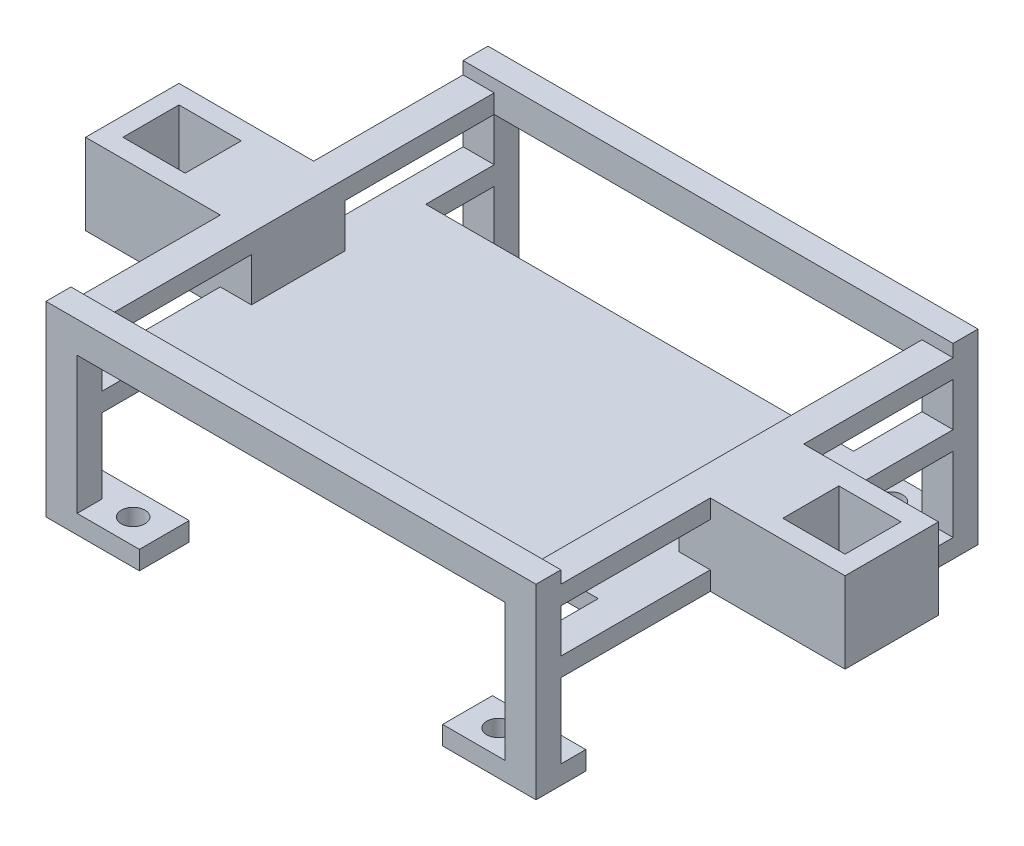
from build123d import *

# Parameters (mm, degrees)
SKETCH1_W             = 5
SKETCH1_H             = 63
BOSS_EXTRUDE1_DEPTH   = 3
BOSS_EXTRUDE1_2_DEPTH = 3
SKETCH3_W             = 78.71
SKETCH3_H             = 5
BOSS_EXTRUDE3_DEPTH   = 4
SKETCH4_W             = 78.71
SKETCH4_H             = 5
BOSS_EXTRUDE4_DEPTH   = 4
SKETCH6_W             = 15
SKETCH6_H             = 3
BOSS_EXTRUDE5_DEPTH   = 5.645
SKETCH7_W             = 16
SKETCH7_H             = 15
SKETCH7_W_2           = 10
SKETCH7_H_2           = 9
BOSS_EXTRUDE6_DEPTH   = 3
SKETCH5_W             = 5
SKETCH5_H             = 4
LEGS_DEPTH            = 25
SKETCH12_W            = 15
SKETCH12_H            = 8
SKETCH12_R            = 1.905
BOSS_EXTRUDE10_DEPTH  = 3
SKETCH13_W            = 21.645
SKETCH13_H            = 15
SKETCH13_W_2          = 10
SKETCH13_H_2          = 9
COPY_2_DEPTH          = 3
BOSS_EXTRUDE11_DEPTH  = 3
SKETCH15_W            = 10
SKETCH15_H            = 9
BOSS_EXTRUDE12_DEPTH  = 10


with BuildPart() as part:
    # Sketch1 → Boss-Extrude1 (new body)
    with BuildSketch(Plane(origin=(0, 0, 0), x_dir=(1, 0, 0), z_dir=(0, 1, 0))):
        with Locations((-36.855, 0)):
            Rectangle(SKETCH1_W, SKETCH1_H)
    extrude(amount=BOSS_EXTRUDE1_DEPTH)



with BuildPart() as body_2:
    # Sketch1 → Boss-Extrude1 2 (new body)
    with BuildSketch(Plane(origin=(0, 0, 0), x_dir=(1, 0, 0), z_dir=(0, 1, 0))):
        with Locations((36.855, 0)):
            Rectangle(SKETCH1_W, SKETCH1_H)
    extrude(amount=BOSS_EXTRUDE1_2_DEPTH)


with BuildPart() as part_1:
    add(part.part)

    add(body_2.part)  # Boss-Extrude3 merges body 2
    # Sketch3 → Boss-Extrude3 (add)
    with BuildSketch(Plane.XY.offset(31.5)):
        with Locations((0, 2.5)):
            Rectangle(SKETCH3_W, SKETCH3_H)
    extrude(amount=BOSS_EXTRUDE3_DEPTH)

    # Sketch4 → Boss-Extrude4 (add)
    with BuildSketch(Plane(origin=(0, 0, -31.5), x_dir=(-1, 0, 0), z_dir=(0, 0, -1))):
        with Locations((0, 2.5)):
            Rectangle(SKETCH4_W, SKETCH4_H)
    extrude(amount=BOSS_EXTRUDE4_DEPTH)

    # Sketch6 → Boss-Extrude5 (add)
    with BuildSketch(Plane.ZY.offset(39.355)):
        with Locations((0, 1.5)):
            Rectangle(SKETCH6_W, SKETCH6_H)
    extrude(amount=BOSS_EXTRUDE5_DEPTH)

    # Sketch7 → Boss-Extrude6 (add)
    with BuildSketch(Plane(origin=(0, 3, 0), x_dir=(1, 0, 0), z_dir=(0, 1, 0))):
        with Locations((-53, 0)):
            Rectangle(SKETCH7_W, SKETCH7_H)
        with Locations((-53, 0)):
            Rectangle(SKETCH7_W_2, SKETCH7_H_2, mode=Mode.SUBTRACT)
    extrude(amount=-BOSS_EXTRUDE6_DEPTH)

    # Sketch5 → legs (add)
    with BuildSketch(Plane.XZ):
        with Locations((-36.855, 33.5)):
            Rectangle(SKETCH5_W, SKETCH5_H)
        with Locations((36.855, 33.5)):
            Rectangle(SKETCH5_W, SKETCH5_H)
        with Locations((-36.855, -33.5)):
            Rectangle(SKETCH5_W, SKETCH5_H)
        with Locations((36.855, -33.5)):
            Rectangle(SKETCH5_W, SKETCH5_H)
    extrude(amount=LEGS_DEPTH)

    # Sketch12 → Boss-Extrude10 (add)
    # profile 1 of 4: a face of its own
    with BuildSketch(Plane.XZ.offset(25)):
        with Locations((31.855, 31.5)):
            Rectangle(SKETCH12_W, SKETCH12_H)
        with Locations(Location((29.355, 31.5, 0), (0, 0, 270))):
            Circle(SKETCH12_R, mode=Mode.SUBTRACT)
    # profile 2 of 4: a face of its own
    with BuildSketch(Plane.XZ.offset(25)):
        with Locations((31.855, -31.5)):
            Rectangle(SKETCH12_W, SKETCH12_H)
        with Locations(Location((29.355, -31.5, 0), (0, 0, 90))):
            Circle(SKETCH12_R, mode=Mode.SUBTRACT)
    # profile 3 of 4: a face of its own
    with BuildSketch(Plane.XZ.offset(25)):
        with Locations((-31.855, -31.5)):
            Rectangle(SKETCH12_W, SKETCH12_H)
        with Locations(Location((-29.355, -31.5, 0), (0, 0, 270))):
            Circle(SKETCH12_R, mode=Mode.SUBTRACT)
    # profile 4 of 4: a face of its own
    with BuildSketch(Plane.XZ.offset(25)):
        with Locations((-31.855, 31.5)):
            Rectangle(SKETCH12_W, SKETCH12_H)
        with Locations(Location((-29.355, 31.5, 0), (0, 0, 90))):
            Circle(SKETCH12_R, mode=Mode.SUBTRACT)
    extrude(amount=-BOSS_EXTRUDE10_DEPTH)

    # Sketch13 → copy 2 (add)
    with BuildSketch(Plane(origin=(0, 3, 0), x_dir=(1, 0, 0), z_dir=(0, 1, 0))):
        with Locations((50.1775, 0)):
            Rectangle(SKETCH13_W, SKETCH13_H)
        with Locations((53, 0)):
            Rectangle(SKETCH13_W_2, SKETCH13_H_2, mode=Mode.SUBTRACT)
    extrude(amount=-COPY_2_DEPTH)

    # Sketch14 → Boss-Extrude11 (add)
    with BuildSketch(Plane(origin=(0, -10, 0), x_dir=(-1, 0, 0), z_dir=(0, -1, 0))):
        Polygon((-39.355, 35.5), (-34.355, 35.5), (-34.355, 20.5), (34.355, 20.5), (34.355, 35.5), (39.355, 35.5), (39.355, -35.5), (34.355, -35.5), (34.355, -20.5), (-34.355, -20.5), (-34.355, -35.5), (-39.355, -35.5), align=None)
    extrude(amount=-BOSS_EXTRUDE11_DEPTH)

    # Sketch15 → Boss-Extrude12 (add)
    # profile 1 of 2: a face of its own
    with BuildSketch(Plane.XZ):
        Polygon((-61, 7.5), (-61, -7.5), (-39.355, -7.5), (-34.355, -7.5), (-34.355, 7.5), (-39.355, 7.5), align=None)
        with Locations((-53, 0)):
            Rectangle(SKETCH15_W, SKETCH15_H, mode=Mode.SUBTRACT)
    # profile 2 of 2: a face of its own
    with BuildSketch(Plane.XZ):
        Polygon((34.355, -7.5), (34.355, 7.5), (39.355, 7.5), (61, 7.5), (61, -7.5), (39.355, -7.5), align=None)
        with Locations((53, 0)):
            Rectangle(SKETCH15_W, SKETCH15_H, mode=Mode.SUBTRACT)
    extrude(amount=BOSS_EXTRUDE12_DEPTH)


solid = part_1.part
